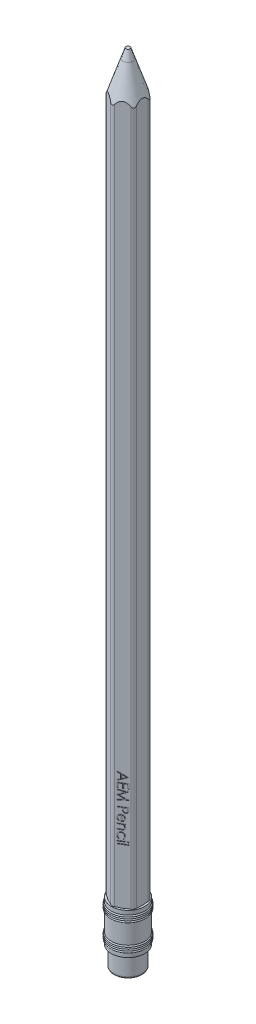
from build123d import *

# Parameters (mm, degrees)
SKETCH1_R           = 1.25
LEAD_DEPTH          = 185
SKETCH2_R           = 1.25
WOODEN_CASING_DEPTH = 185
SKETCH3_R           = 3.5
ERASER_DEPTH        = 10
FILLET1_R           = 0.5
FILLET2_R           = 1
SKETCH6_W           = 1.546794872
SKETCH6_H           = 0.189957265
SKETCH6_W_2         = 2.170940171
TEXT_2_DEPTH        = 0.1


with BuildPart() as part:
    # Sketch1 → Lead (new body)
    with BuildSketch(Plane(origin=(0, 0, 0), x_dir=(1, 0, 0), z_dir=(0, 1, 0))):
        with Locations(Location((0, 0, 0), (0, 0, 270))):
            Circle(SKETCH1_R)
    extrude(amount=LEAD_DEPTH)


with BuildPart() as body_2:
    # Sketch2 → Wooden Casing (new body)
    with BuildSketch(Plane(origin=(0, 185, 0), x_dir=(1, 0, 0), z_dir=(0, 1, 0))):
        Polygon((3.5, 2.020725942), (0, 4.041451884), (-3.5, 2.020725942), (-3.5, -2.020725942), (0, -4.041451884), (3.5, -2.020725942), align=None)
        with Locations(Location((0, 0, 0), (0, 0, 270))):
            Circle(SKETCH2_R, mode=Mode.SUBTRACT)
    extrude(amount=-WOODEN_CASING_DEPTH)

    # Fillet2
    fillet2_edges = [body_2.edges().sort_by_distance(p)[0] for p in [
        (3.5, 92.5, -2.020725942),
        (0, 92.5, -4.041451884),
        (-3.5, 92.5, -2.020725942),
        (-3.5, 92.5, 2.020725942),
        (0, 92.5, 4.041451884),
        (3.5, 92.5, 2.020725942),
    ]]
    fillet(fillet2_edges, radius=FILLET2_R)

    # Sketch6 → Text 2 (cut)
    # profile 1 of 10: a face of its own
    with BuildSketch(Plane(origin=(1.75, 0, 3.031088913), x_dir=(0.8660254037844386, 0, -0.5000000000000003), z_dir=(0.5000000000000003, 0, 0.8660254037844386))):
        Polygon((1.073290994, 32.86025641), (-1.043375673, 31.883333333), (-1.043375673, 32.089827057), (-0.36495687, 32.40274773), (-0.36495687, 33.362286325), (-1.043375673, 33.684111245), (-1.043375673, 33.891452991), (1.073290994, 32.887393162), align=None)
        Polygon((0.660727559, 32.875944845), (-0.147862852, 33.259251469), (-0.147862852, 32.502814503), align=None, mode=Mode.SUBTRACT)
    # profile 2 of 10: a face of its own
    with BuildSketch(Plane(origin=(1.75, 0, 3.031088913), x_dir=(0.8660254037844386, 0, -0.5000000000000003), z_dir=(0.5000000000000003, 0, 0.8660254037844386))):
        Polygon((1.073290994, 31.557692308), (1.073290994, 30.363675214), (0.856196977, 30.363675214), (0.856196977, 31.367735043), (0.204914925, 31.367735043), (0.204914925, 30.363675214), (-0.012179092, 30.363675214), (-0.012179092, 31.367735043), (-0.826281656, 31.367735043), (-0.826281656, 30.363675214), (-1.043375673, 30.363675214), (-1.043375673, 31.557692308), align=None)
    # profile 3 of 10: a face of its own
    with BuildSketch(Plane(origin=(1.75, 0, 3.031088913), x_dir=(0.8660254037844386, 0, -0.5000000000000003), z_dir=(0.5000000000000003, 0, 0.8660254037844386))):
        Polygon((-1.043375673, 30.092307692), (1.073290994, 29.812883948), (1.073290994, 29.785747196), (-0.663461143, 28.911858974), (1.073290994, 28.040090812), (1.073290994, 28.012530048), (-1.043375673, 27.731410256), (-1.043375673, 27.922215545), (0.479674541, 28.124893162), (-1.043375673, 28.88896234), (-1.043375673, 28.931787527), (0.483066635, 29.698824786), (-1.043375673, 29.901078392), align=None)
    # profile 4 of 10: a face of its own
    with BuildSketch(Plane(origin=(1.75, 0, 3.031088913), x_dir=(0.8660254037844386, 0, -0.5000000000000003), z_dir=(0.5000000000000003, 0, 0.8660254037844386))):
        with BuildLine():
            Line((1.073290994, 26.483119658), (1.073290994, 26.068012153))
            add(Edge.make_bspline(
                [(1.073290994, 26.068012153), (1.073259609, 26.039460795), (1.073199474, 25.984755126), (1.071376271, 25.906308402), (1.068941081, 25.835061564), (1.065565364, 25.771168239), (1.061575998, 25.714431837), (1.055980717, 25.665109089), (1.050138538, 25.622812309), (1.044198926, 25.597468885), (1.041490112, 25.585910791)],
                knots=[0, 0, 0, 0, 1.415646017, 2.712440637, 3.8905458, 4.950247383, 5.884950622, 6.709939814, 7.411656543, 8, 8, 8, 8], degree=3))
            add(Edge.make_bspline(
                [(1.041490112, 25.585910791), (1.037485445, 25.571279428), (1.029570475, 25.542361474), (1.013716897, 25.500693248), (0.994921507, 25.461046924), (0.973491363, 25.423297554), (0.948549654, 25.387868178), (0.920885356, 25.354305277), (0.89051369, 25.322416343), (0.856845878, 25.293284634), (0.821123243, 25.266465156), (0.782550222, 25.243458112), (0.741966342, 25.22399719), (0.698955976, 25.208103544), (0.653780527, 25.196018243), (0.606308116, 25.18708924), (0.556701861, 25.181376354), (0.522798266, 25.180832441), (0.505539258, 25.180555556)],
                knots=[0, 0, 0, 0, 0.999487232, 1.975422798, 2.933948774, 3.889618007, 4.832992075, 5.786114792, 6.754729845, 7.731954186, 8.717668599, 9.695514499, 10.68728626, 11.680675814, 12.71351902, 13.766008651, 14.862761406, 16, 16, 16, 16], degree=3))
            add(Edge.make_bspline(
                [(0.505539258, 25.180555556), (0.488135554, 25.180810417), (0.454084034, 25.181309071), (0.40426811, 25.187293968), (0.356662226, 25.19535556), (0.311371939, 25.207751396), (0.268666211, 25.223986636), (0.227892419, 25.24303183), (0.189744236, 25.266002822), (0.15408317, 25.292397553), (0.120875747, 25.321759707), (0.090362609, 25.353965056), (0.062722366, 25.38888358), (0.037893054, 25.426404308), (0.016450447, 25.466893026), (-0.002755162, 25.509735662), (-0.018884803, 25.555304602), (-0.02736965, 25.586838408), (-0.031683632, 25.602871261)],
                knots=[0, 0, 0, 0, 1.121902311, 2.195077645, 3.232258892, 4.234102512, 5.217864754, 6.176164875, 7.132989551, 8.084763148, 9.034132444, 9.988522005, 10.94243251, 11.903244335, 12.886203696, 13.894208494, 14.929344452, 16, 16, 16, 16], degree=3))
            add(Edge.make_bspline(
                [(-0.031683632, 25.602871261), (-0.034503626, 25.616132077), (-0.040683805, 25.645193927), (-0.047583205, 25.69305643), (-0.053472135, 25.748782449), (-0.057887585, 25.812295923), (-0.06166757, 25.883539842), (-0.064672084, 25.962552745), (-0.066322995, 26.049489735), (-0.066408141, 26.110129963), (-0.066452596, 26.141790198)],
                knots=[0, 0, 0, 0, 0.601384939, 1.31797006, 2.144135048, 3.087295005, 4.142315834, 5.309527816, 6.595305764, 8, 8, 8, 8], degree=3))
            Line((-0.066452596, 26.141790198), (-0.066452596, 26.293162393))
            Line((-0.066452596, 26.293162393), (-1.043375673, 26.293162393))
            Line((-1.043375673, 26.293162393), (-1.043375673, 26.483119658))
            Line((-1.043375673, 26.483119658), (1.073290994, 26.483119658))
        make_face()
        with BuildLine():
            Line((0.856196977, 26.293162393), (0.150641421, 26.293162393))
            Line((0.150641421, 26.293162393), (0.145977292, 25.922576122))
            add(Edge.make_bspline(
                [(0.145977292, 25.922576122), (0.145965976, 25.904481514), (0.145944132, 25.869550245), (0.148387313, 25.818952641), (0.151082305, 25.772130161), (0.155302778, 25.728981124), (0.160863649, 25.689835277), (0.16691655, 25.654189804), (0.175117026, 25.622566538), (0.186551286, 25.58550986), (0.20567256, 25.544357568), (0.234142742, 25.499885476), (0.269436685, 25.46158594), (0.30966459, 25.428664613), (0.354579199, 25.403150672), (0.402258152, 25.383960935), (0.452731451, 25.372783024), (0.487253557, 25.3712747), (0.504691234, 25.370512821)],
                knots=[0, 0, 0, 0, 1.160368111, 2.240066715, 3.248291599, 4.168343349, 5.019594299, 5.784185847, 6.485545725, 7.113397927, 8.269509094, 9.383373363, 10.487084095, 11.595623793, 12.704274681, 13.786671823, 14.88201193, 16, 16, 16, 16], degree=3))
            add(Edge.make_bspline(
                [(0.504691234, 25.370512821), (0.521707013, 25.371278768), (0.555532275, 25.372801377), (0.605129416, 25.384049105), (0.652302514, 25.403113211), (0.696664167, 25.428837499), (0.73672744, 25.46081355), (0.771224853, 25.498264332), (0.799334187, 25.540425127), (0.817351973, 25.579664006), (0.828371426, 25.614495916), (0.83607816, 25.644754089), (0.842232251, 25.67891726), (0.847215104, 25.716997847), (0.851480795, 25.758700291), (0.854375164, 25.804382993), (0.85606938, 25.853872861), (0.856153415, 25.88822973), (0.856196977, 25.906039663)],
                knots=[0, 0, 0, 0, 1.120550889, 2.227516482, 3.330715807, 4.461473166, 5.594337325, 6.694900473, 7.802844763, 8.919519911, 9.52614448, 10.208195984, 10.975273469, 11.811520316, 12.738076669, 13.736566072, 14.826679847, 16, 16, 16, 16], degree=3))
            Line((0.856196977, 25.906039663), (0.856196977, 26.293162393))
        make_face(mode=Mode.SUBTRACT)
    # profile 5 of 10: a face of its own
    with BuildSketch(Plane(origin=(1.75, 0, 3.031088913), x_dir=(0.8660254037844386, 0, -0.5000000000000003), z_dir=(0.5000000000000003, 0, 0.8660254037844386))):
        with BuildLine():
            Line((-0.554914135, 23.53114984), (-0.643532591, 23.362393162))
            add(Edge.make_bspline(
                [(-0.643532591, 23.362393162), (-0.667384464, 23.375842943), (-0.713790763, 23.402010889), (-0.777578809, 23.446978982), (-0.834765766, 23.49417518), (-0.884466349, 23.545227257), (-0.927557314, 23.599506434), (-0.965010063, 23.657092444), (-0.997277311, 23.717792862), (-1.024318173, 23.781821661), (-1.045134288, 23.849732031), (-1.059830706, 23.921712871), (-1.068916725, 23.997895307), (-1.069972047, 24.050114232), (-1.070512425, 24.076852965)],
                knots=[0, 0, 0, 0, 1.120373846, 2.179803828, 3.190307243, 4.151866639, 5.090753574, 6.023181945, 6.960194942, 7.901556876, 8.864247182, 9.862852693, 10.905672442, 12, 12, 12, 12], degree=3))
            add(Edge.make_bspline(
                [(-1.070512425, 24.076852965), (-1.069818657, 24.106572161), (-1.068465317, 24.164545702), (-1.05679797, 24.248934027), (-1.037764684, 24.328387288), (-1.011176009, 24.402901056), (-0.976446116, 24.472292714), (-0.934137414, 24.536700689), (-0.884466473, 24.596461778), (-0.827005978, 24.649700008), (-0.765505813, 24.697606839), (-0.701452277, 24.739956218), (-0.634812797, 24.775114288), (-0.566623741, 24.804680576), (-0.496257573, 24.827081885), (-0.424099948, 24.843479684), (-0.349793318, 24.852751949), (-0.299541977, 24.854189893), (-0.274218355, 24.85491453)],
                knots=[0, 0, 0, 0, 1.145226127, 2.234004399, 3.276654467, 4.290038057, 5.276870678, 6.260645262, 7.254731018, 8.264593254, 9.273837991, 10.257612574, 11.220387342, 12.174754112, 13.118989047, 14.062768009, 15.023752772, 16, 16, 16, 16], degree=3))
            add(Edge.make_bspline(
                [(-0.274218355, 24.85491453), (-0.250454338, 24.854274002), (-0.203357196, 24.853004559), (-0.133648985, 24.845003083), (-0.065898445, 24.830822448), (-4.9279e-05, 24.811363434), (0.063788259, 24.786234823), (0.125653022, 24.755493433), (0.185479178, 24.719091376), (0.223218216, 24.690986473), (0.24222796, 24.676829594)],
                knots=[0, 0, 0, 0, 1.024358464, 2.0301432, 3.019427413, 4.004406732, 4.986367066, 5.972626655, 6.978780325, 8, 8, 8, 8], degree=3))
            add(Edge.make_bspline(
                [(0.24222796, 24.676829594), (0.26512961, 24.657653995), (0.310207443, 24.619910232), (0.369436812, 24.55607377), (0.419053762, 24.486949365), (0.460181887, 24.413403287), (0.49143214, 24.334580753), (0.514720059, 24.251541324), (0.527769618, 24.16333947), (0.529612831, 24.10304155), (0.530555951, 24.072188835)],
                knots=[0, 0, 0, 0, 1.030682036, 2.02871468, 2.997146059, 3.962720338, 4.930598197, 5.918074684, 6.934738563, 8, 8, 8, 8], degree=3))
            add(Edge.make_bspline(
                [(0.530555951, 24.072188835), (0.529737074, 24.040470522), (0.528130623, 23.978246421), (0.513237555, 23.887512709), (0.489620058, 23.801660276), (0.456265146, 23.720723476), (0.41323056, 23.644694103), (0.359925732, 23.574066349), (0.297987175, 23.507632339), (0.250354186, 23.468982865), (0.226115513, 23.449315572)],
                knots=[0, 0, 0, 0, 1.056321875, 2.072262726, 3.055038591, 4.01806755, 4.982017516, 5.957941055, 6.960871419, 8, 8, 8, 8], degree=3))
            add(Edge.make_bspline(
                [(0.226115513, 23.449315572), (0.207849538, 23.435934042), (0.17143917, 23.409260055), (0.112068995, 23.375848714), (0.04995354, 23.346845908), (-0.015911259, 23.323663593), (-0.084745005, 23.304892086), (-0.157039782, 23.291311057), (-0.232774062, 23.283346573), (-0.284376312, 23.281781028), (-0.310683365, 23.280982906)],
                knots=[0, 0, 0, 0, 0.94817472, 1.890038105, 2.849395472, 3.817997239, 4.812318967, 5.836947057, 6.897266129, 8, 8, 8, 8], degree=3))
            Line((-0.310683365, 23.280982906), (-0.310683365, 24.664957265))
            add(Edge.make_bspline(
                [(-0.310683365, 24.664957265), (-0.33106371, 24.664025285), (-0.371140836, 24.662192585), (-0.42979093, 24.653668852), (-0.485633577, 24.6401681), (-0.538430845, 24.621401663), (-0.588356083, 24.597870487), (-0.635753373, 24.569951416), (-0.679902895, 24.536439678), (-0.721376771, 24.49912309), (-0.758297149, 24.457565967), (-0.791368216, 24.413861877), (-0.818933045, 24.367437193), (-0.841644343, 24.318759918), (-0.85912448, 24.267577608), (-0.871161896, 24.213962239), (-0.879203496, 24.158080597), (-0.880099174, 24.119989609), (-0.88055516, 24.100597623)],
                knots=[0, 0, 0, 0, 1.094405546, 2.152104367, 3.174987145, 4.173015398, 5.153654967, 6.133208507, 7.119289451, 8.123438607, 9.122504012, 10.097966803, 11.060604936, 12.014205423, 12.976096155, 13.956823727, 14.959826266, 16, 16, 16, 16], degree=3))
            add(Edge.make_bspline(
                [(-0.88055516, 24.100597623), (-0.880189988, 24.08163716), (-0.879465417, 24.044015965), (-0.872315219, 23.987859877), (-0.860942913, 23.932582142), (-0.84531217, 23.878579793), (-0.826057016, 23.827026979), (-0.802976276, 23.779147246), (-0.777736524, 23.734779292), (-0.748415227, 23.693551003), (-0.712897204, 23.653561128), (-0.66806614, 23.614390787), (-0.615589183, 23.571823121), (-0.575932039, 23.545239109), (-0.554914135, 23.53114984)],
                knots=[0, 0, 0, 0, 0.990963276, 1.966261236, 2.95471375, 3.93937425, 4.902926125, 5.828461241, 6.715766441, 7.568835615, 8.469155523, 9.505141836, 10.677749234, 12, 12, 12, 12], degree=3))
        make_face()
        with BuildLine():
            add(Edge.make_bspline(
                [(-0.1207261, 23.470940171), (-0.095523892, 23.477881035), (-0.047017754, 23.491239963), (0.019993049, 23.519333425), (0.079893519, 23.550253113), (0.131694613, 23.587573533), (0.177380519, 23.630223507), (0.217708968, 23.678966384), (0.25361436, 23.733687436), (0.283952651, 23.794009753), (0.309767648, 23.85790015), (0.327079617, 23.924789954), (0.338938566, 23.993042205), (0.340042948, 24.039206251), (0.340598686, 24.062436565)],
                knots=[0, 0, 0, 0, 1.154756201, 2.222533969, 3.206705588, 4.129403772, 5.035894089, 5.963342549, 6.920206228, 7.923656548, 8.944970878, 9.96070521, 10.973801891, 12, 12, 12, 12], degree=3))
            add(Edge.make_bspline(
                [(0.340598686, 24.062436565), (0.340227209, 24.081394986), (0.339492877, 24.118871799), (0.332578738, 24.174094791), (0.321001127, 24.227224364), (0.305582759, 24.278553054), (0.284339372, 24.327187428), (0.259935804, 24.374393122), (0.229953638, 24.419004102), (0.207121421, 24.446909769), (0.195586667, 24.461007612)],
                knots=[0, 0, 0, 0, 1.048700258, 2.073059931, 3.073189922, 4.055269162, 5.032885305, 6.005420607, 6.992345662, 8, 8, 8, 8], degree=3))
            add(Edge.make_bspline(
                [(0.195586667, 24.461007612), (0.1864582, 24.471103073), (0.167984407, 24.491533826), (0.136156268, 24.518833094), (0.101835085, 24.544971189), (0.063707795, 24.568758684), (0.022208562, 24.590577034), (-0.022312579, 24.610993782), (-0.070193472, 24.629370326), (-0.103559661, 24.639709402), (-0.1207261, 24.645028713)],
                knots=[0, 0, 0, 0, 0.879870761, 1.780643979, 2.707998968, 3.669668524, 4.684282772, 5.740141944, 6.837334558, 8, 8, 8, 8], degree=3))
            Line((-0.1207261, 24.645028713), (-0.1207261, 23.470940171))
        make_face(mode=Mode.SUBTRACT)
    # profile 6 of 10: a face of its own
    with BuildSketch(Plane(origin=(1.75, 0, 3.031088913), x_dir=(0.8660254037844386, 0, -0.5000000000000003), z_dir=(0.5000000000000003, 0, 0.8660254037844386))):
        with BuildLine():
            Line((0.503419199, 22.901068376), (0.503419199, 22.711111111))
            Line((0.503419199, 22.711111111), (0.224419466, 22.711111111))
            add(Edge.make_bspline(
                [(0.224419466, 22.711111111), (0.249724351, 22.690828827), (0.298829362, 22.651470347), (0.3633699, 22.585923631), (0.416555822, 22.516651844), (0.458951926, 22.444079204), (0.490911552, 22.368107193), (0.513992854, 22.289198906), (0.527832726, 22.206881917), (0.529641103, 22.150902472), (0.530555951, 22.122582799)],
                knots=[0, 0, 0, 0, 1.12780773, 2.188550248, 3.19190651, 4.159438251, 5.104880172, 6.052711206, 7.014878035, 8, 8, 8, 8], degree=3))
            add(Edge.make_bspline(
                [(0.530555951, 22.122582799), (0.529498953, 22.093959808), (0.527430153, 22.03793771), (0.511113621, 21.956357695), (0.483082226, 21.880096824), (0.44507229, 21.809322159), (0.397549963, 21.745660082), (0.341889095, 21.690256793), (0.278356361, 21.644042163), (0.219234925, 21.613102736), (0.166812032, 21.592703477), (0.121909679, 21.579863735), (0.07188512, 21.56895905), (0.016888251, 21.559505636), (-0.043465871, 21.55310898), (-0.108929958, 21.548063886), (-0.179482768, 21.544448198), (-0.228278967, 21.544304744), (-0.253441779, 21.544230769)],
                knots=[0, 0, 0, 0, 1.235764744, 2.418689688, 3.575570385, 4.733739044, 5.876600945, 6.994686206, 8.113221397, 9.257403329, 9.866223892, 10.540462211, 11.272173464, 12.077110251, 12.949508505, 13.892531187, 14.913238277, 16, 16, 16, 16], degree=3))
            Line((-0.253441779, 21.544230769), (-1.043375673, 21.544230769))
            Line((-1.043375673, 21.544230769), (-1.043375673, 21.734188034))
            Line((-1.043375673, 21.734188034), (-0.315771506, 21.734188034))
            add(Edge.make_bspline(
                [(-0.315771506, 21.734188034), (-0.294712218, 21.734304879), (-0.254429384, 21.734528383), (-0.196753832, 21.735233322), (-0.144450044, 21.736932586), (-0.097643065, 21.739320375), (-0.05637784, 21.742815313), (-0.020570325, 21.746457571), (0.009734018, 21.750911628), (0.02797671, 21.754880628), (0.036158248, 21.756660657)],
                knots=[0, 0, 0, 0, 1.430800155, 2.736877192, 3.918605307, 4.986035426, 5.920637409, 6.731861385, 7.431261377, 8, 8, 8, 8], degree=3))
            add(Edge.make_bspline(
                [(0.036158248, 21.756660657), (0.06017406, 21.763086574), (0.106397067, 21.775454475), (0.169095366, 21.806015503), (0.22243427, 21.844607889), (0.266084002, 21.89171754), (0.300053984, 21.94688941), (0.323623947, 22.009970396), (0.338365786, 22.080351765), (0.339833623, 22.129854177), (0.340598686, 22.155655716)],
                knots=[0, 0, 0, 0, 1.084156227, 2.086665306, 3.027808233, 3.945421172, 4.874247719, 5.839848303, 6.874090471, 8, 8, 8, 8], degree=3))
            add(Edge.make_bspline(
                [(0.340598686, 22.155655716), (0.340310924, 22.170936702), (0.33974145, 22.201177378), (0.334024102, 22.246019676), (0.324681269, 22.289519598), (0.312039134, 22.332096286), (0.294835853, 22.372846576), (0.274922822, 22.4129613), (0.250538617, 22.451292446), (0.223215782, 22.48856499), (0.1927652, 22.523200506), (0.161104579, 22.555889675), (0.126900995, 22.584610639), (0.091365629, 22.610681386), (0.053784159, 22.633158922), (0.014558439, 22.652787045), (-0.026373612, 22.669439121), (-0.054782277, 22.677713954), (-0.068996667, 22.6818543)],
                knots=[0, 0, 0, 0, 1.02388931, 2.02625049, 3.024079426, 4.004119353, 4.998163158, 5.985366248, 7.002659681, 8.039138713, 9.080111048, 10.09169763, 11.086418407, 12.069932368, 13.043171485, 14.017654831, 15.008125612, 16, 16, 16, 16], degree=3))
            add(Edge.make_bspline(
                [(-0.068996667, 22.6818543), (-0.079431956, 22.68423685), (-0.102149035, 22.689423535), (-0.139429232, 22.695025553), (-0.182554788, 22.700110135), (-0.23147538, 22.704365819), (-0.286362285, 22.706969571), (-0.346981101, 22.709808563), (-0.413573544, 22.710842138), (-0.459935616, 22.711018943), (-0.484104172, 22.711111111)],
                knots=[0, 0, 0, 0, 0.615963638, 1.340920617, 2.168419149, 3.115676021, 4.16674242, 5.331190069, 6.6087489, 8, 8, 8, 8], degree=3))
            Line((-0.484104172, 22.711111111), (-1.043375673, 22.711111111))
            Line((-1.043375673, 22.711111111), (-1.043375673, 22.901068376))
            Line((-1.043375673, 22.901068376), (0.503419199, 22.901068376))
        make_face()
    # profile 7 of 10: a face of its own
    with BuildSketch(Plane(origin=(1.75, 0, 3.031088913), x_dir=(0.8660254037844386, 0, -0.5000000000000003), z_dir=(0.5000000000000003, 0, 0.8660254037844386))):
        with BuildLine():
            Line((0.168025903, 19.590384615), (0.069231165, 19.749389022))
            add(Edge.make_bspline(
                [(0.069231165, 19.749389022), (0.090900648, 19.766823254), (0.133553347, 19.801139578), (0.18856648, 19.860746246), (0.236008897, 19.924301219), (0.274154623, 19.99300282), (0.304266746, 20.066249114), (0.325194275, 20.144191001), (0.338348394, 20.226804433), (0.339836298, 20.28345132), (0.340598686, 20.312476629)],
                knots=[0, 0, 0, 0, 1.026629843, 2.020746545, 2.988156479, 3.951609825, 4.916760838, 5.907688704, 6.927920211, 8, 8, 8, 8], degree=3))
            add(Edge.make_bspline(
                [(0.340598686, 20.312476629), (0.339959509, 20.335674638), (0.338700668, 20.381362485), (0.330832969, 20.448434692), (0.316533186, 20.512321749), (0.297701485, 20.573432423), (0.272426035, 20.631301759), (0.24185328, 20.68609188), (0.205852952, 20.737986046), (0.164684402, 20.78615987), (0.119466449, 20.83006306), (0.071714361, 20.868891764), (0.0210938, 20.901299483), (-0.031434479, 20.928313905), (-0.086774142, 20.948639065), (-0.144252893, 20.963585687), (-0.204248956, 20.972696256), (-0.245071477, 20.973800131), (-0.26573812, 20.974358974)],
                knots=[0, 0, 0, 0, 1.11253269, 2.191102883, 3.232049486, 4.248096668, 5.252846381, 6.25411548, 7.252444123, 8.276484619, 9.287796331, 10.271127345, 11.222403915, 12.165070373, 13.097940083, 14.043161362, 15.009338842, 16, 16, 16, 16], degree=3))
            add(Edge.make_bspline(
                [(-0.26573812, 20.974358974), (-0.292814018, 20.973285381), (-0.346600991, 20.97115266), (-0.425975441, 20.954363896), (-0.502862875, 20.927058543), (-0.576235646, 20.888953464), (-0.644265369, 20.841545326), (-0.705777692, 20.786225981), (-0.758211524, 20.72176814), (-0.802094586, 20.650063693), (-0.837514011, 20.572407333), (-0.862507331, 20.489414657), (-0.877677525, 20.401792414), (-0.879583421, 20.341794896), (-0.88055516, 20.311204594)],
                knots=[0, 0, 0, 0, 0.966447457, 1.919872872, 2.884287729, 3.873230387, 4.863319139, 5.838939256, 6.818209587, 7.819967013, 8.834377336, 9.85802846, 10.90789553, 12, 12, 12, 12], degree=3))
            add(Edge.make_bspline(
                [(-0.88055516, 20.311204594), (-0.879769274, 20.283170744), (-0.878224798, 20.228076791), (-0.865204902, 20.14754229), (-0.843890895, 20.070870629), (-0.814168268, 19.998064535), (-0.775749247, 19.929257044), (-0.728360605, 19.864892733), (-0.673365614, 19.803690866), (-0.630839983, 19.767709361), (-0.609187639, 19.749389022)],
                knots=[0, 0, 0, 0, 1.039848629, 2.043578496, 3.018386758, 3.987534228, 4.954977003, 5.934852016, 6.948509513, 8, 8, 8, 8], degree=3))
            Line((-0.609187639, 19.749389022), (-0.71349453, 19.590384615))
            add(Edge.make_bspline(
                [(-0.71349453, 19.590384615), (-0.727337856, 19.599811545), (-0.754978562, 19.618634114), (-0.793953594, 19.650097237), (-0.830427494, 19.684040908), (-0.864389371, 19.720305601), (-0.896434952, 19.758431081), (-0.92565608, 19.79940974), (-0.952792184, 19.842543955), (-0.97738356, 19.888031625), (-0.999439926, 19.935424767), (-1.018527637, 19.984724828), (-1.034666252, 20.035709104), (-1.047725007, 20.088263028), (-1.058056033, 20.142469535), (-1.064927021, 20.198287344), (-1.07005127, 20.255706011), (-1.070357374, 20.294514828), (-1.070512425, 20.314172676)],
                knots=[0, 0, 0, 0, 0.954067324, 1.904967979, 2.850944488, 3.791040077, 4.734579251, 5.686741025, 6.656553487, 7.63677735, 8.631289747, 9.633371755, 10.647134148, 11.676547777, 12.717490898, 13.789379914, 14.88025357, 16, 16, 16, 16], degree=3))
            add(Edge.make_bspline(
                [(-1.070512425, 20.314172676), (-1.069973413, 20.344175449), (-1.068916945, 20.4029811), (-1.057300392, 20.489052333), (-1.039787926, 20.571308211), (-1.014651774, 20.649720669), (-0.982294084, 20.72430178), (-0.942768859, 20.7949825), (-0.895746987, 20.861526923), (-0.842068734, 20.923284066), (-0.783858372, 20.979983193), (-0.721081388, 21.028740713), (-0.655832083, 21.070804838), (-0.587350554, 21.105494516), (-0.515377706, 21.13169944), (-0.44047695, 21.150349417), (-0.362650036, 21.16222327), (-0.30959568, 21.163612127), (-0.28269859, 21.164316239)],
                knots=[0, 0, 0, 0, 1.112900083, 2.181292239, 3.217426397, 4.231060065, 5.231907716, 6.230057215, 7.231385915, 8.250448267, 9.26326716, 10.242335464, 11.195469137, 12.140906363, 13.085222324, 14.031808558, 15.002181388, 16, 16, 16, 16], degree=3))
            add(Edge.make_bspline(
                [(-0.28269859, 21.164316239), (-0.264450742, 21.164033304), (-0.228152761, 21.163470498), (-0.174205615, 21.157622347), (-0.121213954, 21.14886318), (-0.069253828, 21.136428035), (-0.018168062, 21.120823959), (0.031770518, 21.101212631), (0.080852482, 21.078261806), (0.128473489, 21.051560206), (0.174345168, 21.022106587), (0.218206345, 20.990100455), (0.258933669, 20.954991482), (0.297546433, 20.917522408), (0.332891813, 20.877125571), (0.366496853, 20.834553549), (0.39662051, 20.788755793), (0.424749936, 20.740899521), (0.449752354, 20.690922903), (0.471304723, 20.639177686), (0.489720544, 20.58596225), (0.5043009, 20.531195089), (0.516527573, 20.47523874), (0.524218856, 20.417652514), (0.529653408, 20.358656643), (0.530252602, 20.318708477), (0.530555951, 20.298484241)],
                knots=[0, 0, 0, 0, 0.991083503, 1.971428668, 2.944771278, 3.907728914, 4.872032831, 5.84458753, 6.820199395, 7.813689706, 8.808455339, 9.780676499, 10.761021664, 11.727616056, 12.70141294, 13.675300653, 14.672050164, 15.67696011, 16.690052069, 17.705469636, 18.720567748, 19.746988726, 20.783187267, 21.830086354, 22.901455311, 24, 24, 24, 24], degree=3))
            add(Edge.make_bspline(
                [(0.530555951, 20.298484241), (0.529998575, 20.273156676), (0.528886608, 20.222628145), (0.519523508, 20.147674585), (0.505418809, 20.073819991), (0.484479758, 20.002383882), (0.459317242, 19.934266799), (0.430515497, 19.870627972), (0.397880949, 19.81246522), (0.361602797, 19.759238223), (0.320889507, 19.710735658), (0.275037853, 19.666437659), (0.224325213, 19.625414699), (0.186947218, 19.602157677), (0.168025903, 19.590384615)],
                knots=[0, 0, 0, 0, 1.095247575, 2.185020588, 3.262981163, 4.344680461, 5.40090428, 6.402280576, 7.363136638, 8.282296962, 9.184898179, 10.097200524, 11.036773704, 12, 12, 12, 12], degree=3))
        make_face()
    # profile 8 of 10: a face of its own
    with BuildSketch(Plane(origin=(1.75, 0, 3.031088913), x_dir=(0.8660254037844386, 0, -0.5000000000000003), z_dir=(0.5000000000000003, 0, 0.8660254037844386))):
        with BuildLine():
            add(Edge.make_bspline(
                [(1.15470125, 19.143476229), (1.154152081, 19.131690592), (1.153076703, 19.10861205), (1.143941309, 19.075205309), (1.128220056, 19.044816751), (1.107813486, 19.017460594), (1.082827676, 18.994783597), (1.054438273, 18.978522983), (1.023531989, 18.968142257), (1.001997148, 18.96688132), (0.991032714, 18.966239316)],
                knots=[0, 0, 0, 0, 1.054986045, 2.065865298, 3.074122704, 4.105114675, 5.109626121, 6.074217918, 7.019490725, 8, 8, 8, 8], degree=3))
            add(Edge.make_bspline(
                [(0.991032714, 18.966239316), (0.980352882, 18.966895682), (0.959240119, 18.96819324), (0.92886971, 18.978515309), (0.900875624, 18.994919923), (0.875938663, 19.0174455), (0.855543882, 19.044820738), (0.839819514, 19.075204255), (0.830684943, 19.108612328), (0.829609451, 19.131690685), (0.829060224, 19.143476229)],
                knots=[0, 0, 0, 0, 0.961106377, 1.899993565, 2.859409042, 3.870007927, 4.90724781, 5.921615355, 6.938620636, 8, 8, 8, 8], degree=3))
            add(Edge.make_bspline(
                [(0.829060224, 19.143476229), (0.829591812, 19.155126412), (0.830626477, 19.177801973), (0.839928801, 19.210594462), (0.855509688, 19.240494057), (0.876220899, 19.267402839), (0.900709809, 19.290375018), (0.928890856, 19.306719104), (0.959234735, 19.31706877), (0.980351074, 19.318362609), (0.991032714, 19.319017094)],
                knots=[0, 0, 0, 0, 1.055304112, 2.054011575, 3.063363921, 4.096942562, 5.122536081, 6.088009498, 7.032825006, 8, 8, 8, 8], degree=3))
            add(Edge.make_bspline(
                [(0.991032714, 19.319017094), (1.001999025, 19.318377041), (1.023537553, 19.317119937), (1.054416766, 19.306711071), (1.082994905, 19.290513026), (1.107531454, 19.267387996), (1.128254175, 19.240497943), (1.143832052, 19.21059345), (1.153135162, 19.177802241), (1.154169719, 19.155126503), (1.15470125, 19.143476229)],
                knots=[0, 0, 0, 0, 0.986662878, 1.937868148, 2.908513651, 3.927890639, 4.955204348, 5.958438607, 6.951092507, 8, 8, 8, 8], degree=3))
        make_face()
    # profile 9 of 10: a face of its own
    with BuildSketch(Plane(origin=(1.75, 0, 3.031088913), x_dir=(0.8660254037844386, 0, -0.5000000000000003), z_dir=(0.5000000000000003, 0, 0.8660254037844386))):
        with Locations((-0.269978237, 19.142628206)):
            Rectangle(SKETCH6_W, SKETCH6_H)
    # profile 10 of 10: a face of its own
    with BuildSketch(Plane(origin=(1.75, 0, 3.031088913), x_dir=(0.8660254037844386, 0, -0.5000000000000003), z_dir=(0.5000000000000003, 0, 0.8660254037844386))):
        with Locations((0.042094413, 18.545619659)):
            Rectangle(SKETCH6_W_2, SKETCH6_H)
    extrude(amount=-TEXT_2_DEPTH, mode=Mode.SUBTRACT)


with BuildPart() as body_3:
    # Sketch3 → Eraser (new body)
    with BuildSketch(Plane.XZ):
        with Locations(Location((0, 0, 0), (0, 0, 270))):
            Circle(SKETCH3_R)
    extrude(amount=ERASER_DEPTH)

    # Fillet1
    fillet1_edges = [body_3.edges().sort_by_distance(p)[0] for p in [
        (0, -10, 3.5),
    ]]
    fillet(fillet1_edges, radius=FILLET1_R)


with BuildPart() as body_4:
    # Sketch4 → Ferrule (revolve)
    with BuildSketch(Plane.XY, mode=Mode.PRIVATE) as ferrule_sk:
        with BuildLine():
            Line((4.1, -5), (3.6, -5))
            Line((3.6, -5), (3.6, -4))
            ThreePointArc((3.6, -4), (3.4, -3.8), (3.6, -3.6))
            ThreePointArc((3.6, -3.6), (3.4, -3.4), (3.6, -3.2))
            ThreePointArc((3.6, -3.2), (3.4, -3), (3.6, -2.8))
            ThreePointArc((3.6, -2.8), (3.4, -2.6), (3.6, -2.4))
            Line((3.6, -2.4), (3.6, 2.4))
            ThreePointArc((3.6, 2.4), (3.4, 2.6), (3.6, 2.8))
            ThreePointArc((3.6, 2.8), (3.4, 3), (3.6, 3.2))
            ThreePointArc((3.6, 3.2), (3.4, 3.4), (3.6, 3.6))
            ThreePointArc((3.6, 3.6), (3.4, 3.8), (3.6, 4))
            Line((3.6, 4), (3.6, 5))
            Line((3.6, 5), (4.1, 5))
            Line((4.1, 5), (4.1, 4))
            ThreePointArc((4.1, 4), (4.3, 3.8), (4.1, 3.6))
            ThreePointArc((4.1, 3.6), (4.3, 3.4), (4.1, 3.2))
            ThreePointArc((4.1, 3.2), (4.3, 3), (4.1, 2.8))
            ThreePointArc((4.1, 2.8), (4.3, 2.6), (4.1, 2.4))
            Line((4.1, 2.4), (4.1, -2.4))
            ThreePointArc((4.1, -2.4), (4.3, -2.6), (4.1, -2.8))
            ThreePointArc((4.1, -2.8), (4.3, -3), (4.1, -3.2))
            ThreePointArc((4.1, -3.2), (4.3, -3.4), (4.1, -3.6))
            ThreePointArc((4.1, -3.6), (4.3, -3.8), (4.1, -4))
            Line((4.1, -4), (4.1, -5))
        make_face()
    revolve(ferrule_sk.sketch.rotate(Axis((0, -10, 0), (0, 1, 0)), 90), axis=Axis((0, -10, 0), (0, 1, 0)))


with BuildPart() as sharpening_cut_tool:
    # Sketch7 → Sharpening Cut (revolve)
    with BuildSketch(Plane.XY):
        Polygon((0.5, 185), (5.5, 185), (5.5, 170), align=None)
    revolve(axis=Axis((0, 185, 0), (0, -1, 0)))


with BuildPart() as part_1:
    add(part.part)

    # Sharpening Cut: cut by sharpening_cut_tool
    add(sharpening_cut_tool.part, mode=Mode.SUBTRACT)


with BuildPart() as body_2_1:
    add(body_2.part)

    # Sharpening Cut: cut by sharpening_cut_tool
    add(sharpening_cut_tool.part, mode=Mode.SUBTRACT)


solid = Compound([body_3.part, body_4.part, part_1.part, body_2_1.part])
